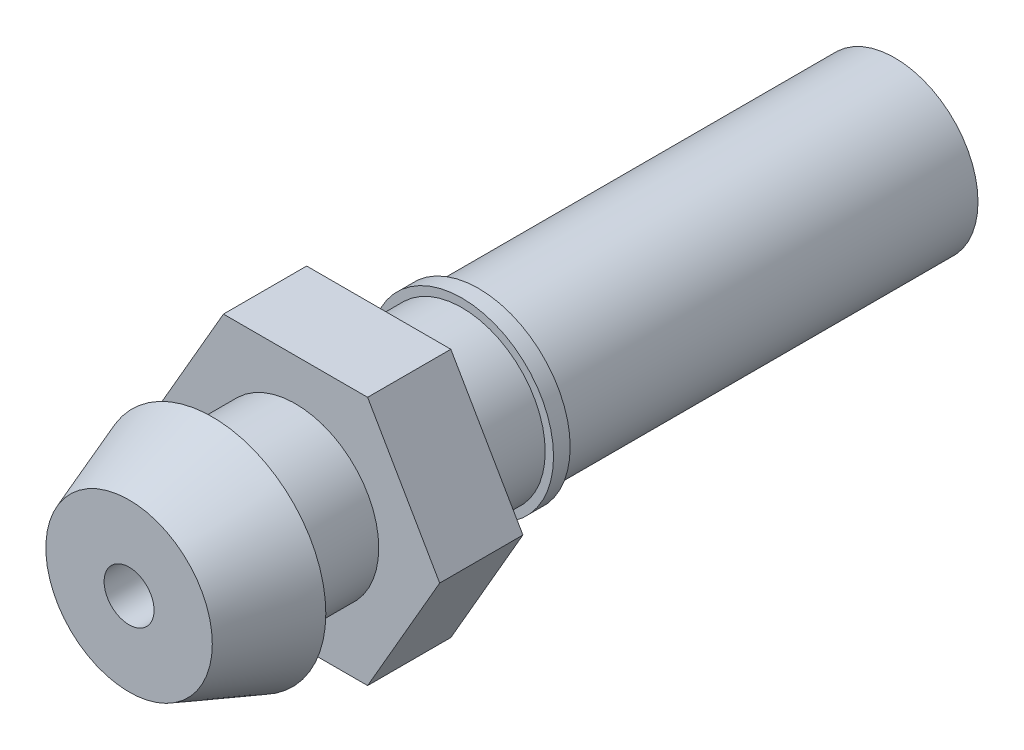
from build123d import *

# Parameters (mm, degrees)
SKETCH1_R           = 1.27
BOSS_EXTRUDE1_DEPTH = 6.35
SKETCH2_R           = 1.397
BOSS_EXTRUDE2_DEPTH = 0.254
SKETCH3_R           = 1.27
BOSS_EXTRUDE3_DEPTH = 1.27
BOSS_EXTRUDE4_DEPTH = 1.27
SKETCH5_R           = 1.27
BOSS_EXTRUDE5_DEPTH = 1.27
SKETCH6_R           = 1.27
BOSS_EXTRUDE6_DEPTH = 1.27
DRAFT3_ANGLE        = 20
SKETCH7_R           = 0.381
CUT_EXTRUDE1_DEPTH  = 13.040912798


with BuildPart() as part:
    # Sketch1 → Boss-Extrude1 (new body)
    with BuildSketch(Plane.XY):
        Circle(SKETCH1_R)
    extrude(amount=BOSS_EXTRUDE1_DEPTH)

    # Sketch2 → Boss-Extrude2 (add)
    with BuildSketch(Plane.XY.offset(6.35)):
        Circle(SKETCH2_R)
    extrude(amount=BOSS_EXTRUDE2_DEPTH)

    # Sketch3 → Boss-Extrude3 (add)
    with BuildSketch(Plane.XY.offset(6.604)):
        Circle(SKETCH3_R)
    extrude(amount=BOSS_EXTRUDE3_DEPTH)

    # Sketch4 → Boss-Extrude4 (add)
    with BuildSketch(Plane.XY.offset(7.874)):
        Polygon((2.199704526, 0), (1.099852263, 1.905), (-1.099852263, 1.905), (-2.199704526, 0), (-1.099852263, -1.905), (1.099852263, -1.905), align=None)
    extrude(amount=BOSS_EXTRUDE4_DEPTH)

    # Sketch5 → Boss-Extrude5 (add)
    with BuildSketch(Plane.XY.offset(9.144)):
        Circle(SKETCH5_R)
    extrude(amount=BOSS_EXTRUDE5_DEPTH)


with BuildPart() as body_2:
    # Sketch6 → Boss-Extrude6 (new body)
    with BuildSketch(Plane.XY.offset(10.414)):
        Circle(SKETCH6_R)
    extrude(amount=BOSS_EXTRUDE6_DEPTH)

    # Draft3
    draft3_faces = [body_2.faces().sort_by_distance(p)[0] for p in [
        (-1.27, 0, 11.049),
    ]]
    draft(draft3_faces, Plane.XY.offset(11.684), DRAFT3_ANGLE)


with BuildPart() as cut_extrude1_tool:
    # Sketch7 → Cut-Extrude1 (new, through all)
    with BuildSketch(Plane.XY.offset(11.684)):
        Circle(SKETCH7_R)
    extrude(amount=-CUT_EXTRUDE1_DEPTH)


with BuildPart() as part_1:
    add(part.part)

    # Cut-Extrude1: cut by cut_extrude1_tool
    add(cut_extrude1_tool.part, mode=Mode.SUBTRACT)


with BuildPart() as body_2_1:
    add(body_2.part)

    # Cut-Extrude1: cut by cut_extrude1_tool
    add(cut_extrude1_tool.part, mode=Mode.SUBTRACT)


solid = Compound([part_1.part, body_2_1.part])
